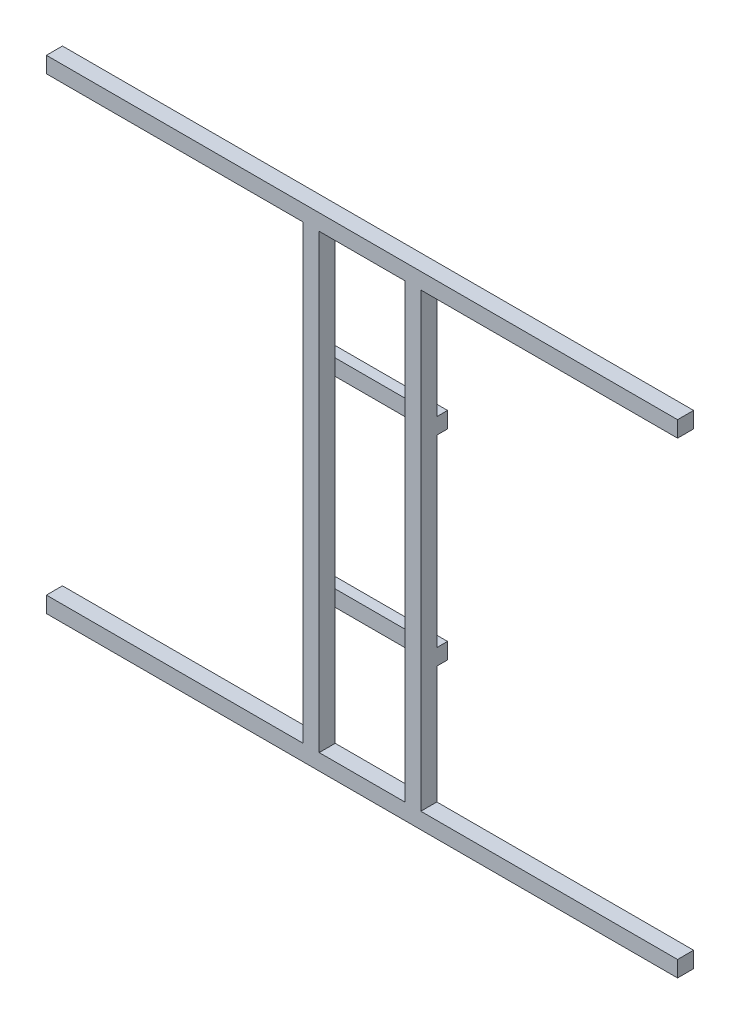
from build123d import *

# Parameters (mm, degrees)
SKETCH1_W        = 110
SKETCH1_H        = 15
EXTRUDE1_DEPTH   = 10
EXTRUDE1_2_DEPTH = 10
SKETCH2_W        = 80
SKETCH2_H        = 421.99984649
EXTRUDE2_DEPTH   = 15


with BuildPart() as part:
    # Sketch1 → Extrude1 (new body)
    with BuildSketch(Plane.XY):
        with Locations((0, 93.499923245)):
            Rectangle(SKETCH1_W, SKETCH1_H)
    extrude(amount=EXTRUDE1_DEPTH)



with BuildPart() as body_2:
    # Sketch1 → Extrude1 2 (new body)
    with BuildSketch(Plane.XY):
        with Locations((0, -93.499923245)):
            Rectangle(SKETCH1_W, SKETCH1_H)
    extrude(amount=EXTRUDE1_2_DEPTH)


with BuildPart() as part_1:
    add(part.part)

    add(body_2.part)  # Extrude2 merges body 2
    # Sketch2 → Extrude2 (add)
    with BuildSketch(Plane.XY.offset(10)):
        Polygon((55, -210.999923245), (55, 210.999923245), (295, 210.999923245), (295, 225.999923245), (-295, 225.999923245), (-295, 210.999923245), (-55, 210.999923245), (-55, -210.999923245), (-295, -210.999923245), (-295, -225.999923245), (295, -225.999923245), (295, -210.999923245), align=None)
        Rectangle(SKETCH2_W, SKETCH2_H, mode=Mode.SUBTRACT)
    extrude(amount=EXTRUDE2_DEPTH)


solid = part_1.part
